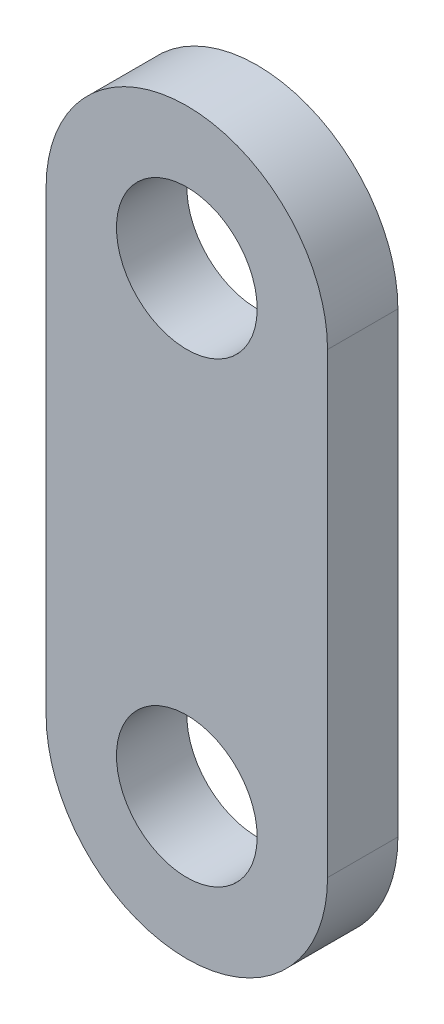
from build123d import *

# Parameters (mm, degrees)
BOSS_EXTRUDE1_DEPTH = 3.175
SKETCH2_R           = 3.175
CUT_EXTRUDE1_DEPTH  = 3.175


with BuildPart() as part:
    # Sketch1 → Boss-Extrude1 (new body)
    with BuildSketch(Plane.XY):
        with BuildLine():
            Line((6.35, 10.31875), (6.35, -10.31875))
            ThreePointArc((6.35, -10.31875), (0, -16.66875), (-6.35, -10.31875))
            Line((-6.35, -10.31875), (-6.35, 10.31875))
            ThreePointArc((-6.35, 10.31875), (0, 16.66875), (6.35, 10.31875))
        make_face()
    extrude(amount=BOSS_EXTRUDE1_DEPTH)

    # Sketch2 → Cut-Extrude1 (cut)
    with BuildSketch(Plane.XY.offset(3.175)):
        with Locations((0, 10.31875)):
            Circle(SKETCH2_R)
        with Locations((0, -10.31875)):
            Circle(SKETCH2_R)
    extrude(amount=-CUT_EXTRUDE1_DEPTH, mode=Mode.SUBTRACT)


solid = part.part
